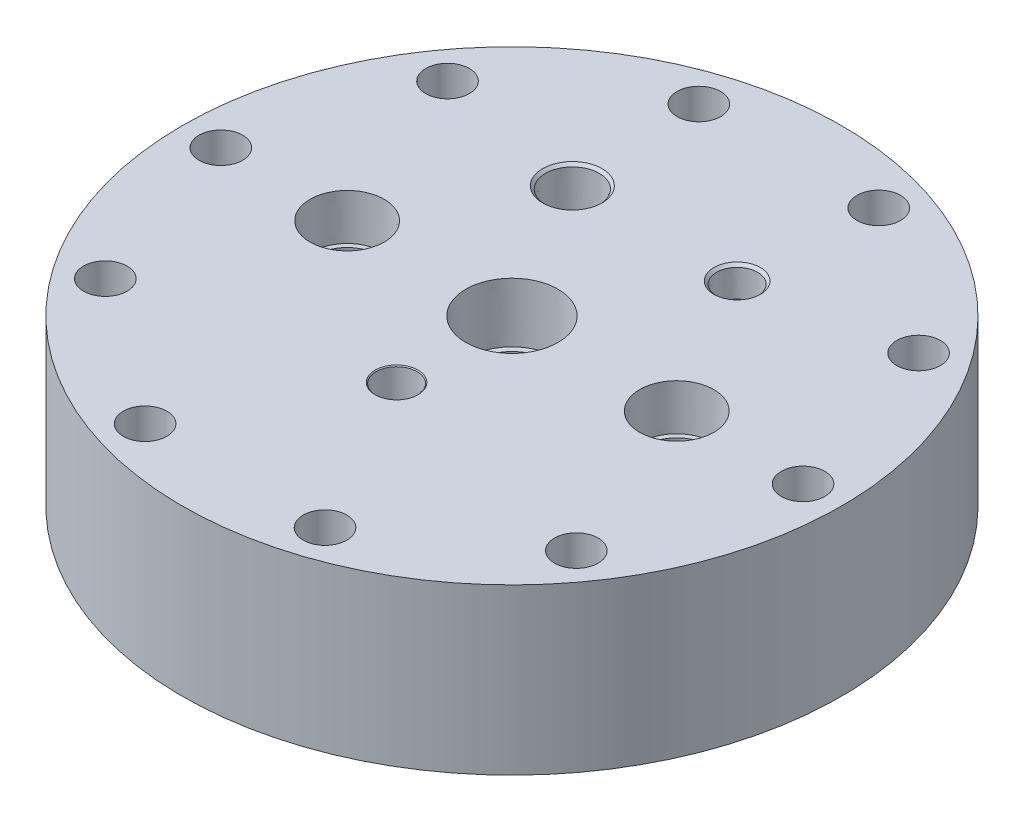
from build123d import *

# Parameters (mm, degrees)
F_3_8_NPT_TAPPED_HOLE1_AT_2_COUNT = 2
F_3_8_NPT_TAPPED_HOLE1_AT_2_PITCH = 76.2
F_3_8_CLEARANCE_HOLE2_D           = 10.0838
CIRPATTERN1_COUNT                 = 10
SKETCH15_R                        = 3.175
CUT_EXTRUDE1_DEPTH                = 12.7


with BuildPart() as part:
    # Sketch1 → Revolve1 (revolve)
    with BuildSketch(Plane.XY):
        Polygon((0, 0), (-76.2, 0), (-76.2, -38.1), (-60.96, -38.1), (-60.96, -32.258), (-55.7149, -32.258), (-55.7149, -29.5656), (-51.6509, -29.5656), (-51.6509, -32.258), (-32.163982831, -32.258), (-30.364664072, -32.258), (-28.575, -32.258), (-28.575, -27.178), (-28.0924, -27.178), (-28.0924, -24.4856), (-24.0284, -24.4856), (-24.0284, -27.178), (-22.225, -27.178), (0, -15.85722), align=None)
    revolve(axis=Axis((0, 0, 0), (0, -1, 0)))

    # Sketch3 → 1/2 NPT Tapped Hole1 (revolve, cut)
    with BuildSketch(Plane(origin=(0, 0, 0), x_dir=(0, 0, 1), z_dir=(1, 0, 0))):
        Polygon((0, 0), (0, 38.1), (8.9281, 38.1), (8.9281, 13.462), (10.261665792, 13.462), (10.6647361, 0), align=None)
    revolve(axis=Axis((0, 6.35, 0), (0, -1, 0)), mode=Mode.SUBTRACT)

    # Sketch5 → 3/8 NPT Tapped Hole1 (revolve, cut)
    with BuildSketch(Plane(origin=(-38.1, 0, 0), x_dir=(0, 0, 1), z_dir=(1, 0, 0))):
        Polygon((0, 0), (0, 38.1), (7.1374, 38.1), (7.1374, 10.414), (8.263205494, 10.414), (8.5750146, 0), align=None)
    f_3_8_npt_tapped_hole1 = revolve(axis=Axis((-38.1, 6.35, 0), (0, -1, 0)), mode=Mode.SUBTRACT)

    # 3/8 NPT Tapped Hole1 at 2: 3/8 NPT Tapped Hole1 ×2
    with Locations(*[(i * F_3_8_NPT_TAPPED_HOLE1_AT_2_PITCH, 0, 0) for i in range(1, F_3_8_NPT_TAPPED_HOLE1_AT_2_COUNT)]):
        add(f_3_8_npt_tapped_hole1, mode=Mode.SUBTRACT)

    # 3/8 Clearance Hole2 (through all)
    with Locations(Plane(origin=(67.31, 0, 0), x_dir=(1, 0, 0), z_dir=(0, 1, 0))):
        with Locations((0, 0)):
            f_3_8_clearance_hole2 = Hole(F_3_8_CLEARANCE_HOLE2_D / 2)

    # CirPattern1: 3/8 Clearance Hole2 ×10 about axis
    cirpattern1_axis = Axis((0, 0, 0), (0, 1, 0))
    for i in range(1, CIRPATTERN1_COUNT):
        add(f_3_8_clearance_hole2.rotate(cirpattern1_axis, i * 360 / CIRPATTERN1_COUNT), mode=Mode.SUBTRACT)

    # Sketch7 → 1/8 NPT Tapped Hole2 (revolve, cut)
    with BuildSketch(Plane(origin=(19.05, 0, -33.02), x_dir=(0, 0, 1), z_dir=(1, 0, 0))):
        Polygon((0, 0), (0, 38.1), (4.2164, 38.1), (4.2164, 6.858), (4.556413846, 6.858), (4.7427388, 0.635), (5.3777388, 0), align=None)
    revolve(axis=Axis((19.05, 6.35, -33.02), (0, -1, 0)), mode=Mode.SUBTRACT)

    # Sketch15 → Cut-Extrude1 (cut, symmetric)
    with BuildSketch(Plane(origin=(0, -4.272551224, -4.272551224), x_dir=(0, 0.7071067811865489, -0.7071067811865461), z_dir=(0, -0.7071067811865461, -0.7071067811865489))):
        with Locations((-30.172299887, 0)):
            Circle(SKETCH15_R)
    extrude(amount=CUT_EXTRUDE1_DEPTH, both=True, mode=Mode.SUBTRACT)

    # Sketch12 → 1/8 NPT Tapped Hole3 (revolve, cut)
    with BuildSketch(Plane(origin=(0, 0, 26.67), x_dir=(0, 0, 1), z_dir=(1, 0, 0))):
        Polygon((0, 0), (0, 20.32), (4.2164, 17.786531286), (4.2164, 6.858), (4.543696598, 6.858), (4.7427388, 0.2102612), (4.953, 0), align=None)
    revolve(axis=Axis((0, 6.35, 26.67), (0, -1, 0)), mode=Mode.SUBTRACT)

    # Sketch17 → 1/4 NPT Tapped Hole1 (revolve, cut)
    with BuildSketch(Plane(origin=(-19.05, 0, -33.02), x_dir=(0, 0, 1), z_dir=(1, 0, 0))):
        Polygon((0, 0), (0, 38.1), (5.5626, 38.1), (5.5626, 9.906), (5.962698545, 9.906), (6.2402847, 0.635), (6.8752847, 0), align=None)
    revolve(axis=Axis((-19.05, 6.35, -33.02), (0, -1, 0)), mode=Mode.SUBTRACT)


solid = part.part
